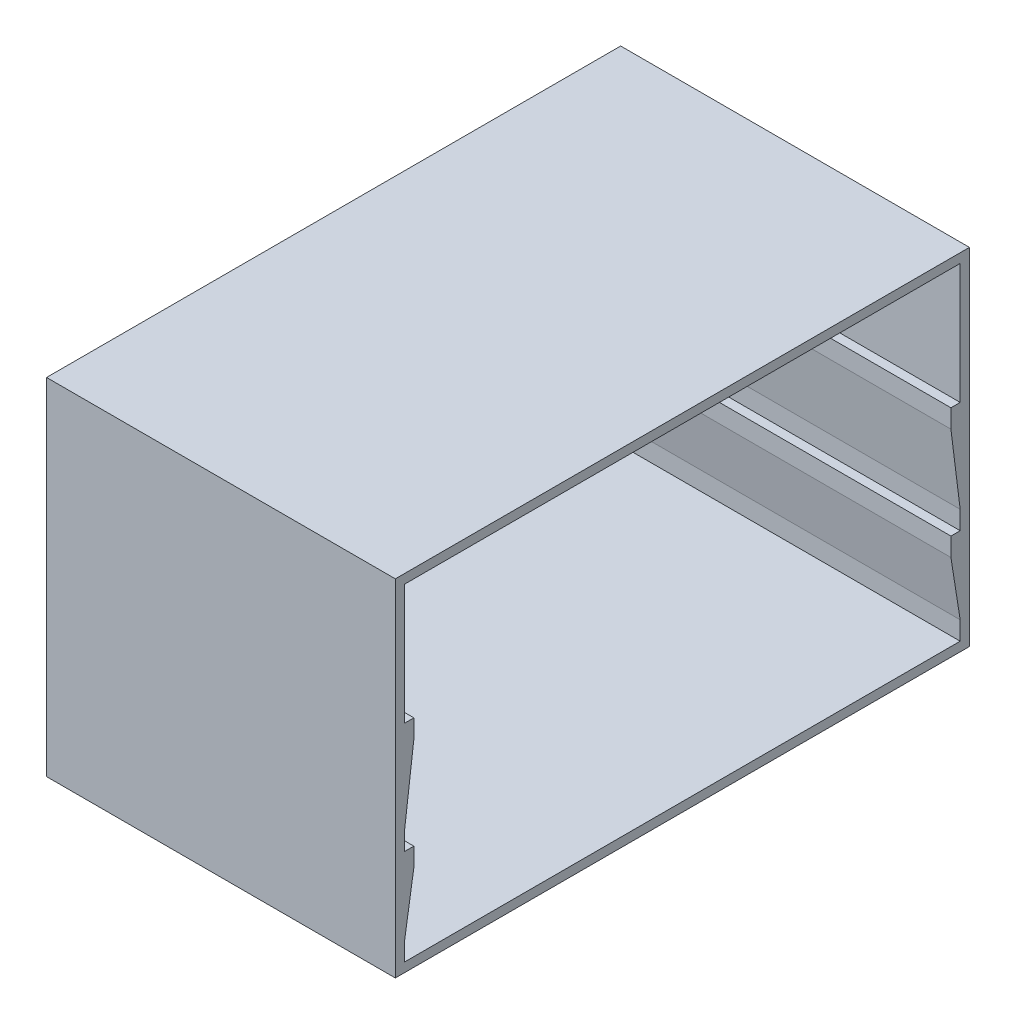
from build123d import *

# Parameters (mm, degrees)
BOSS_EXTRUDE1_DEPTH           = 110
SKETCH2_W                     = 186
SKETCH2_H                     = 112
BOSS_EXTRUDE2_DEPTH           = 3
SKETCH3_W                     = 16
SKETCH3_H                     = 16
BOSS_EXTRUDE3_DEPTH           = 3
BOSS_EXTRUDE3_DRAFT           = 50
BOSS_EXTRUDE3_PROFILE_2_DEPTH = 3
BOSS_EXTRUDE3_PROFILE_2_DRAFT = 50
BOSS_EXTRUDE3_PROFILE_3_DEPTH = 3
BOSS_EXTRUDE3_PROFILE_3_DRAFT = 50
BOSS_EXTRUDE3_PROFILE_4_DEPTH = 3
BOSS_EXTRUDE3_PROFILE_4_DRAFT = 50


with BuildPart() as part:
    # Sketch1 → Boss-Extrude1 (new body)
    with BuildSketch(Plane(origin=(0, 0, 0), x_dir=(0, 0, -1), z_dir=(1, 0, 0))):
        Polygon((-3, 0), (-3, 106), (-3, 109), (183, 109), (183, 106), (183, 0), (183, -3), (-3, -3), align=None)
        Polygon((0, 0), (0, 6), (3, 25), (3, 31), (0, 31), (0, 37), (3, 61), (3, 67), (0, 67), (0, 106), (180, 106), (180, 67), (177, 67), (177, 61), (180, 37), (180, 31), (177, 31), (177, 25), (180, 6), (180, 0), align=None, mode=Mode.SUBTRACT)
    extrude(amount=BOSS_EXTRUDE1_DEPTH)

    # Sketch2 → Boss-Extrude2 (add)
    with BuildSketch(Plane.ZY):
        with Locations((-90, 53)):
            Rectangle(SKETCH2_W, SKETCH2_H)
    extrude(amount=BOSS_EXTRUDE2_DEPTH)


with BuildPart() as boss_extrude3_tool:
    # Sketch3 → Boss-Extrude3 (with draft: the straight prism first)
    with BuildSketch(Plane.XZ.offset(3)):
        with Locations((5, -5)):
            Rectangle(SKETCH3_W, SKETCH3_H)
    extrude(amount=BOSS_EXTRUDE3_DEPTH)
    # Boss-Extrude3: the draft: its side faces are tilted about the plane it starts from
    boss_extrude3_sides = [boss_extrude3_tool.faces().sort_by_distance(p)[0] for p in [
        (-3, -4.5, -5),
        (5, -4.5, -13),
        (13, -4.5, -5),
        (5, -4.5, 3),
    ]]
    draft(boss_extrude3_sides, Plane.XZ.offset(3), BOSS_EXTRUDE3_DRAFT)


with BuildPart() as part_1:
    add(part.part)

    # Boss-Extrude3: add boss_extrude3_tool
    add(boss_extrude3_tool.part)


with BuildPart() as boss_extrude3_profile_2_tool:
    # Sketch3 → Boss-Extrude3 profile 2 (with draft: the straight prism first)
    with BuildSketch(Plane.XZ.offset(3)):
        with Locations((102, -5)):
            Rectangle(SKETCH3_W, SKETCH3_H)
    extrude(amount=BOSS_EXTRUDE3_PROFILE_2_DEPTH)
    # Boss-Extrude3 profile 2: the draft: its side faces are tilted about the plane it starts from
    boss_extrude3_profile_2_sides = [boss_extrude3_profile_2_tool.faces().sort_by_distance(p)[0] for p in [
        (102, -4.5, 3),
        (94, -4.5, -5),
        (102, -4.5, -13),
        (110, -4.5, -5),
    ]]
    draft(boss_extrude3_profile_2_sides, Plane.XZ.offset(3), BOSS_EXTRUDE3_PROFILE_2_DRAFT)


with BuildPart() as part_2:
    add(part_1.part)

    # Boss-Extrude3 profile 2: add boss_extrude3_profile_2_tool
    add(boss_extrude3_profile_2_tool.part)


with BuildPart() as boss_extrude3_profile_3_tool:
    # Sketch3 → Boss-Extrude3 profile 3 (with draft: the straight prism first)
    with BuildSketch(Plane.XZ.offset(3)):
        with Locations((102, -175)):
            Rectangle(SKETCH3_W, SKETCH3_H)
    extrude(amount=BOSS_EXTRUDE3_PROFILE_3_DEPTH)
    # Boss-Extrude3 profile 3: the draft: its side faces are tilted about the plane it starts from
    boss_extrude3_profile_3_sides = [boss_extrude3_profile_3_tool.faces().sort_by_distance(p)[0] for p in [
        (110, -4.5, -175),
        (102, -4.5, -167),
        (94, -4.5, -175),
        (102, -4.5, -183),
    ]]
    draft(boss_extrude3_profile_3_sides, Plane.XZ.offset(3), BOSS_EXTRUDE3_PROFILE_3_DRAFT)


with BuildPart() as part_3:
    add(part_2.part)

    # Boss-Extrude3 profile 3: add boss_extrude3_profile_3_tool
    add(boss_extrude3_profile_3_tool.part)


with BuildPart() as boss_extrude3_profile_4_tool:
    # Sketch3 → Boss-Extrude3 profile 4 (with draft: the straight prism first)
    with BuildSketch(Plane.XZ.offset(3)):
        with Locations((5, -175)):
            Rectangle(SKETCH3_W, SKETCH3_H)
    extrude(amount=BOSS_EXTRUDE3_PROFILE_4_DEPTH)
    # Boss-Extrude3 profile 4: the draft: its side faces are tilted about the plane it starts from
    boss_extrude3_profile_4_sides = [boss_extrude3_profile_4_tool.faces().sort_by_distance(p)[0] for p in [
        (5, -4.5, -183),
        (13, -4.5, -175),
        (5, -4.5, -167),
        (-3, -4.5, -175),
    ]]
    draft(boss_extrude3_profile_4_sides, Plane.XZ.offset(3), BOSS_EXTRUDE3_PROFILE_4_DRAFT)


with BuildPart() as part_4:
    add(part_3.part)

    # Boss-Extrude3 profile 4: add boss_extrude3_profile_4_tool
    add(boss_extrude3_profile_4_tool.part)


solid = part_4.part
